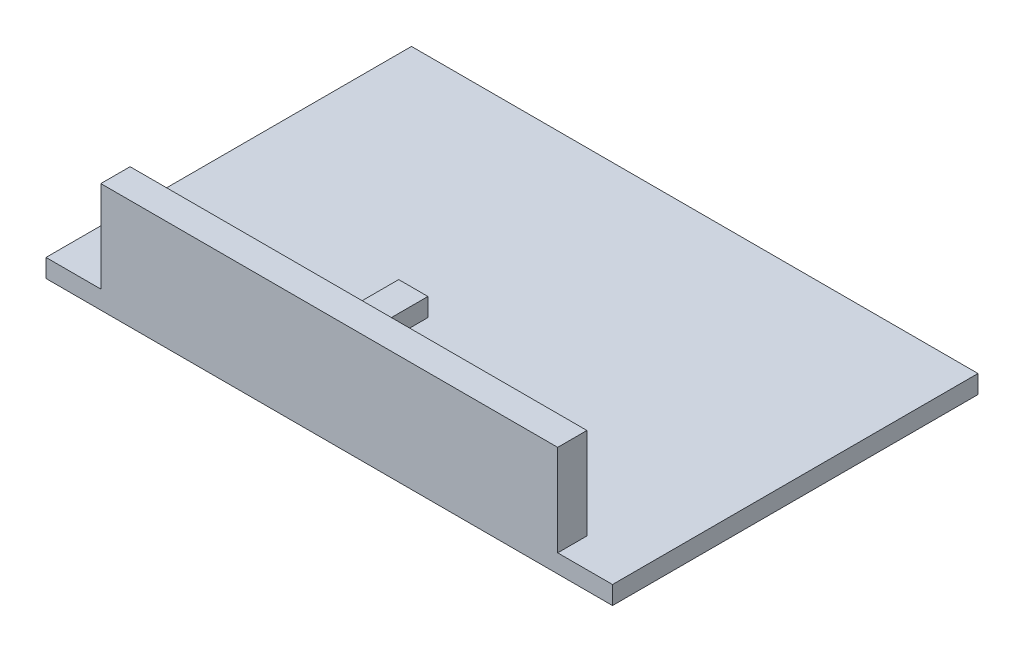
from build123d import *

# Parameters (mm, degrees)
SKETCH_1_W      = 155
SKETCH_1_H      = 100
EXTRUDE_1_DEPTH = 5
SKETCH_2_W      = 125
SKETCH_2_H      = 8
EXTRUDE_2_DEPTH = 25
SKETCH_7_W      = 8
SKETCH_7_H      = 5
EXTRUDE_3_DEPTH = 15


with BuildPart() as part:
    # 草图1 → 凸台-拉伸1 (new body)
    with BuildSketch(Plane(origin=(0, 0, 0), x_dir=(1, 0, 0), z_dir=(0, 1, 0))):
        with Locations((77.5, 50)):
            Rectangle(SKETCH_1_W, SKETCH_1_H)
    extrude(amount=EXTRUDE_1_DEPTH)

    # 草图2 → 凸台-拉伸2 (add)
    with BuildSketch(Plane(origin=(0, 5, 0), x_dir=(1, 0, 0), z_dir=(0, 1, 0))):
        with Locations((77.5, 4)):
            Rectangle(SKETCH_2_W, SKETCH_2_H)
    extrude(amount=EXTRUDE_2_DEPTH)

    # 草图7 → 凸台-拉伸3 (add)
    with BuildSketch(Plane(origin=(0, 0, -8), x_dir=(-1, 0, 0), z_dir=(0, 0, -1))):
        with Locations((-77.5, 22.5)):
            Rectangle(SKETCH_7_W, SKETCH_7_H)
    extrude(amount=EXTRUDE_3_DEPTH)


solid = part.part
